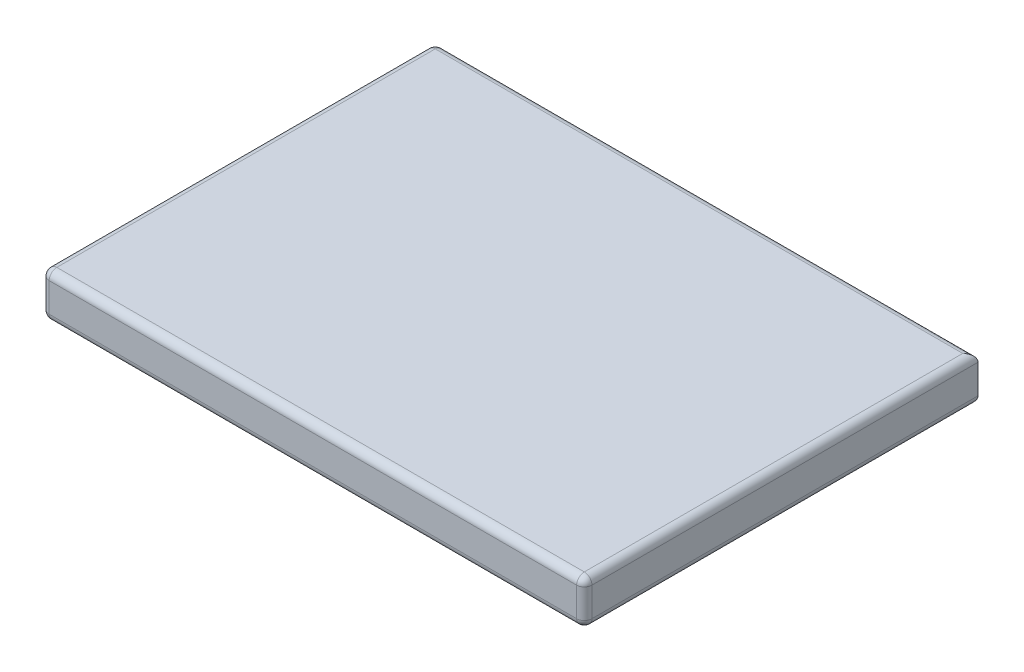
from build123d import *

# Parameters (mm, degrees)
SKETCH1_W           = 71
SKETCH1_H           = 51.5
BOSS_EXTRUDE1_DEPTH = 5.8
FILLET1_R           = 1


with BuildPart() as part:
    # Sketch1 → Boss-Extrude1 (new body)
    with BuildSketch(Plane(origin=(0, 0, 0), x_dir=(1, 0, 0), z_dir=(0, 1, 0))):
        with Locations((35.5, 25.75)):
            Rectangle(SKETCH1_W, SKETCH1_H)
    extrude(amount=BOSS_EXTRUDE1_DEPTH)

    # Fillet1
    fillet1_edges = [part.edges().sort_by_distance(p)[0] for p in [
        (71, 5.8, -25.75),
        (35.5, 5.8, -51.5),
        (0, 5.8, -25.75),
        (35.5, 0, -51.5),
        (71, 0, -25.75),
        (35.5, 0, 0),
        (0, 0, -25.75),
        (35.5, 5.8, 0),
        (0, 2.9, -51.5),
        (71, 2.9, 0),
        (0, 2.9, 0),
    ]]
    fillet(fillet1_edges, radius=FILLET1_R)


solid = part.part
